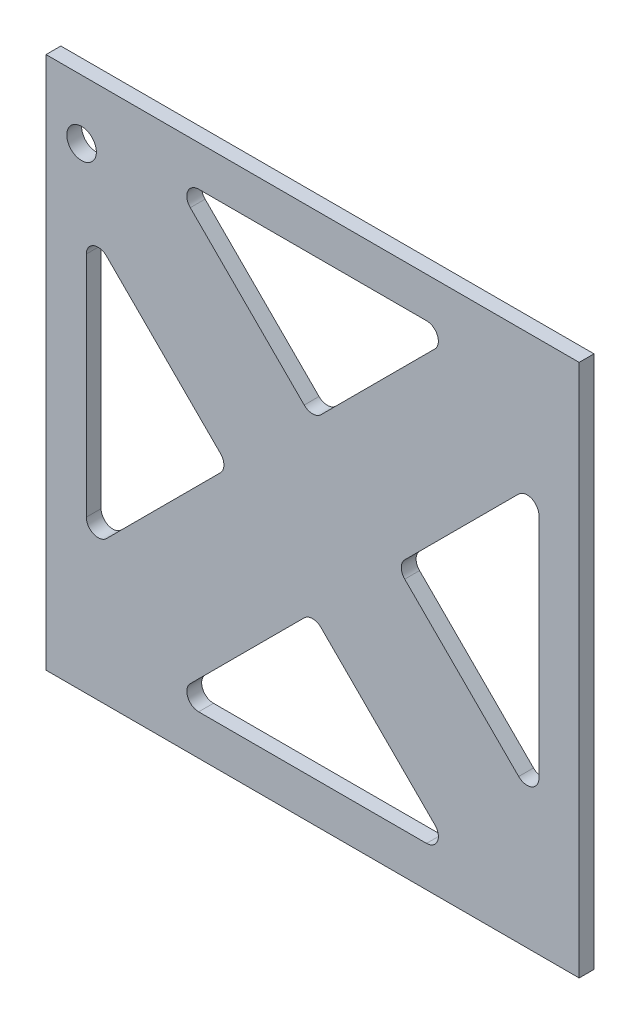
from build123d import *

# Parameters (mm, degrees)
SKETCH1_W           = 114.3
SKETCH1_H           = 114.3
SKETCH1_R           = 3.175
BOSS_EXTRUDE2_DEPTH = 1.5875


with BuildPart() as part:
    # Sketch1 → Boss-Extrude2 (new, symmetric)
    with BuildSketch(Plane.XY):
        Rectangle(SKETCH1_W, SKETCH1_H)
        with Locations((-49.53, 44.45)):
            Circle(SKETCH1_R, mode=Mode.SUBTRACT)
        with BuildLine():
            Line((-24.425187853, -48.517802544), (24.425187853, -48.517802544))
            ThreePointArc((24.425187853, -48.517802544), (26.771841866, -46.949818462), (26.221239077, -44.181751319))
            Line((26.221239077, -44.181751319), (1.796051224, -19.756563466))
            ThreePointArc((1.796051224, -19.756563466), (0, -19.012614691), (-1.796051224, -19.756563466))
            Line((-1.796051224, -19.756563466), (-26.221239077, -44.181751319))
            ThreePointArc((-26.221239077, -44.181751319), (-26.771841866, -46.949818462), (-24.425187853, -48.517802544))
        make_face(mode=Mode.SUBTRACT)
        with BuildLine():
            Line((-48.517802544, 24.425187853), (-48.517802544, -24.425187853))
            ThreePointArc((-48.517802544, -24.425187853), (-46.949818462, -26.771841866), (-44.181751319, -26.221239077))
            Line((-44.181751319, -26.221239077), (-19.756563466, -1.796051224))
            ThreePointArc((-19.756563466, -1.796051224), (-19.012614691, 0), (-19.756563466, 1.796051224))
            Line((-19.756563466, 1.796051224), (-44.181751319, 26.221239077))
            ThreePointArc((-44.181751319, 26.221239077), (-46.949818462, 26.771841866), (-48.517802544, 24.425187853))
        make_face(mode=Mode.SUBTRACT)
        with BuildLine():
            Line((24.425187853, 48.517802544), (-24.425187853, 48.517802544))
            ThreePointArc((-24.425187853, 48.517802544), (-26.771841866, 46.949818462), (-26.221239077, 44.181751319))
            Line((-26.221239077, 44.181751319), (-1.796051224, 19.756563466))
            ThreePointArc((-1.796051224, 19.756563466), (0, 19.012614691), (1.796051224, 19.756563466))
            Line((1.796051224, 19.756563466), (26.221239077, 44.181751319))
            ThreePointArc((26.221239077, 44.181751319), (26.771841866, 46.949818462), (24.425187853, 48.517802544))
        make_face(mode=Mode.SUBTRACT)
        with BuildLine():
            Line((48.517802544, -24.425187853), (48.517802544, 24.425187853))
            ThreePointArc((48.517802544, 24.425187853), (46.949818462, 26.771841866), (44.181751319, 26.221239077))
            Line((44.181751319, 26.221239077), (19.756563466, 1.796051224))
            ThreePointArc((19.756563466, 1.796051224), (19.012614691, 0), (19.756563466, -1.796051224))
            Line((19.756563466, -1.796051224), (44.181751319, -26.221239077))
            ThreePointArc((44.181751319, -26.221239077), (46.949818462, -26.771841866), (48.517802544, -24.425187853))
        make_face(mode=Mode.SUBTRACT)
    extrude(amount=BOSS_EXTRUDE2_DEPTH, both=True)


solid = part.part
